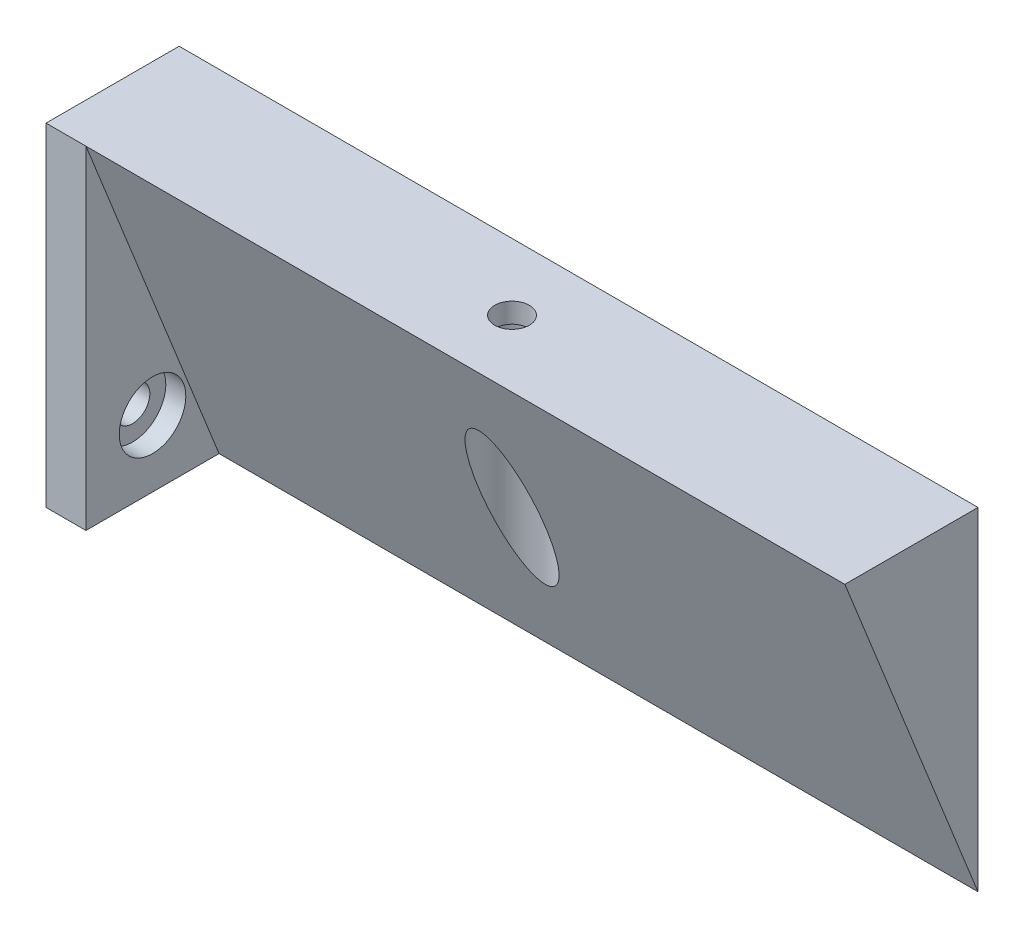
from build123d import *

# Parameters (mm, degrees)
SKETCH_1_W          = 120
SKETCH_1_H          = 20
EXTRUDE_1_DEPTH     = 50
SKETCH_2_W          = 6
SKETCH_2_H          = 20
EXTRUDE_2_DEPTH     = 20
CUT_EXTRUDE_1_DEPTH = 114
SKETCH_4_R          = 2.6
SKETCH_4_W          = 20
SKETCH_4_H          = 20
CUT_EXTRUDE_2_DEPTH = 114
SKETCH_5_R          = 5
CUT_EXTRUDE_3_DEPTH = 3
CUT_EXTRUDE_4_DEPTH = 300
SKETCH_8_R          = 5
CUT_EXTRUDE_5_DEPTH = 300
SKETCH_9_R          = 5
SKETCH_9_R_2        = 2.6
EXTRUDE_3_DEPTH     = 3


with BuildPart() as part:
    # 草图1 → 凸台-拉伸1 (new body)
    with BuildSketch(Plane(origin=(0, 0, 0), x_dir=(1, 0, 0), z_dir=(0, 1, 0))):
        with Locations((60, 10)):
            Rectangle(SKETCH_1_W, SKETCH_1_H)
    extrude(amount=EXTRUDE_1_DEPTH)

    # 草图2 → 凸台-拉伸2 (add)
    with BuildSketch(Plane.XY):
        with Locations((3, -10)):
            Rectangle(SKETCH_2_W, SKETCH_2_H)
    extrude(amount=-EXTRUDE_2_DEPTH)

    # 草图3 → 切除-拉伸1 (cut)
    with BuildSketch(Plane(origin=(120, 0, 0), x_dir=(0, 0, -1), z_dir=(1, 0, 0))):
        Polygon((0, 50), (20, 0), (0, 0), align=None)
    extrude(amount=-CUT_EXTRUDE_1_DEPTH, mode=Mode.SUBTRACT)

    # 草图4 → 切除-拉伸2 (cut)
    with BuildSketch(Plane(origin=(6, 0, 0), x_dir=(0, 0, -1), z_dir=(1, 0, 0))):
        with Locations(Location((10, 10, 0), (0, 0, 90))):
            Circle(SKETCH_4_R)
        with Locations((10, -10)):
            Rectangle(SKETCH_4_W, SKETCH_4_H)
    extrude(amount=-CUT_EXTRUDE_2_DEPTH, mode=Mode.SUBTRACT)

    # 草图5 → 切除-拉伸3 (cut)
    with BuildSketch(Plane(origin=(6, 0, 0), x_dir=(0, 0, -1), z_dir=(1, 0, 0))):
        with Locations(Location((10, 10, 0), (0, 0, 90))):
            Circle(SKETCH_5_R)
    extrude(amount=-CUT_EXTRUDE_3_DEPTH, mode=Mode.SUBTRACT)

    # 草图6 → 切除-拉伸4 (cut)
    with BuildSketch(Plane(origin=(0, 50, 0), x_dir=(1, 0, 0), z_dir=(0, 1, 0))):
        with BuildLine():
            ThreePointArc((62.6, 10), (61.838477631, 11.838477631), (60, 12.6))
            Line((60, 12.6), (60, 7.4))
            ThreePointArc((60, 7.4), (61.838477631, 8.161522369), (62.6, 10))
        make_face()
        with BuildLine():
            Line((60, 7.4), (60, 12.6))
            ThreePointArc((60, 12.6), (57.4, 10), (60, 7.4))
        make_face()
    extrude(amount=-CUT_EXTRUDE_4_DEPTH, mode=Mode.SUBTRACT)

    # 草图8 → 切除-拉伸5 (cut)
    with BuildSketch(Plane(origin=(0, 50, 0), x_dir=(1, 0, 0), z_dir=(0, 1, 0))):
        with Locations(Location((60, 10, 0), (0, 0, 270))):
            Circle(SKETCH_8_R)
    extrude(amount=-CUT_EXTRUDE_5_DEPTH, mode=Mode.SUBTRACT)

    # 草图9 → 凸台-拉伸3 (add)
    with BuildSketch(Plane(origin=(0, 50, 0), x_dir=(1, 0, 0), z_dir=(0, 1, 0))):
        with Locations(Location((60, 10, 0), (0, 0, 270))):
            Circle(SKETCH_9_R)
        with Locations(Location((60, 10, 0), (0, 0, 270))):
            Circle(SKETCH_9_R_2, mode=Mode.SUBTRACT)
    extrude(amount=-EXTRUDE_3_DEPTH)


solid = part.part
